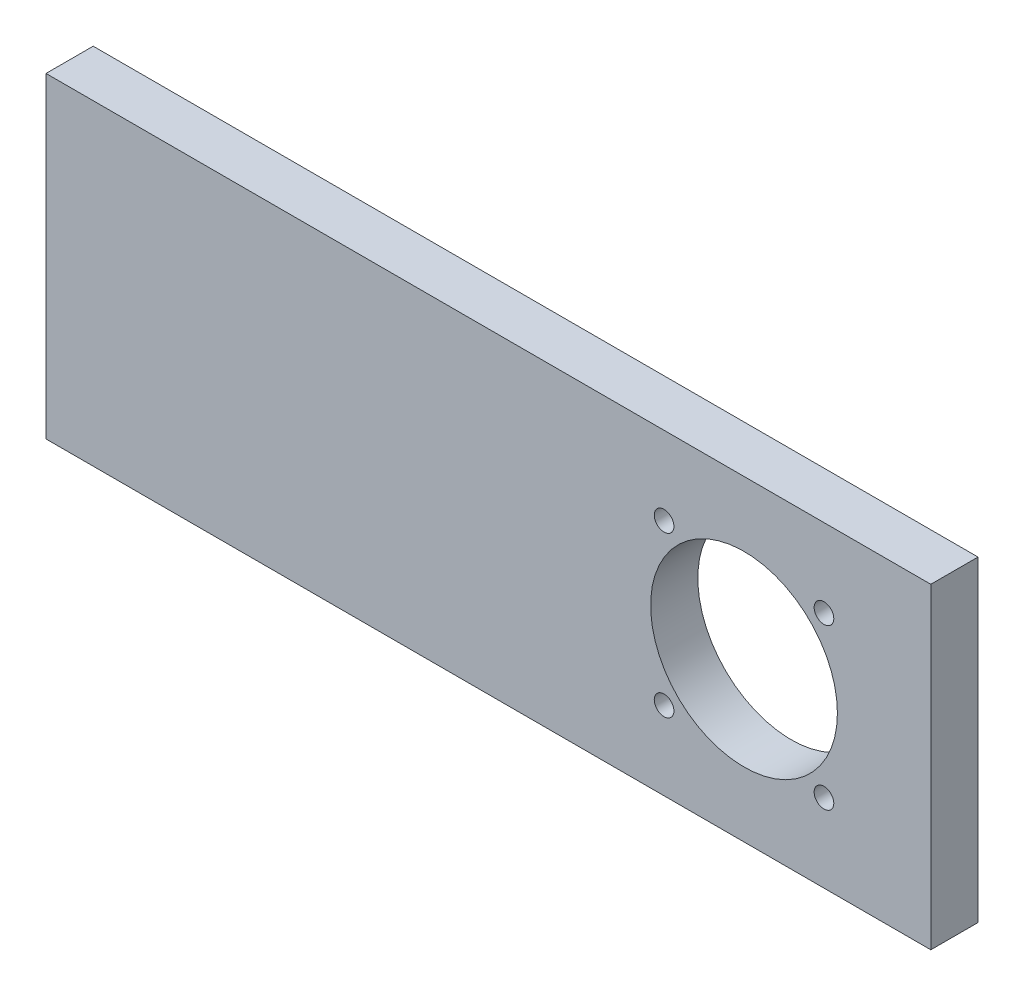
from build123d import *

# Parameters (mm, degrees)
SKETCH_1_W          = 450
SKETCH_1_H          = 161
SKETCH_1_R          = 47.5
EXTRUDE_1_DEPTH     = 24
CUT_EXTRUDE_START   = 24
SKETCH_1_3_R        = 5
CUT_EXTRUDE_1_DEPTH = 18


with BuildPart() as part:
    # 草图1 → 凸台-拉伸1 (new body)
    with BuildSketch(Plane.XY):
        Rectangle(SKETCH_1_W, SKETCH_1_H)
        with Locations((130, 0)):
            Circle(SKETCH_1_R, mode=Mode.SUBTRACT)
    extrude(amount=EXTRUDE_1_DEPTH)

    # 草图1<3> → 切除-拉伸1 (cut)
    with BuildSketch(Plane.XY.offset(CUT_EXTRUDE_START)):
        with Locations(Location((89.341360082, 40.658639918, 0), (0, 0, 180))):
            Circle(SKETCH_1_3_R)
        with Locations(Location((170.658639918, 40.658639918, 0), (0, 0, 180))):
            Circle(SKETCH_1_3_R)
        with Locations(Location((170.658639918, -40.658639918, 0), (0, 0, 180))):
            Circle(SKETCH_1_3_R)
        with Locations(Location((89.341360082, -40.658639918, 0), (0, 0, 180))):
            Circle(SKETCH_1_3_R)
    extrude(amount=-CUT_EXTRUDE_1_DEPTH, mode=Mode.SUBTRACT)


solid = part.part
